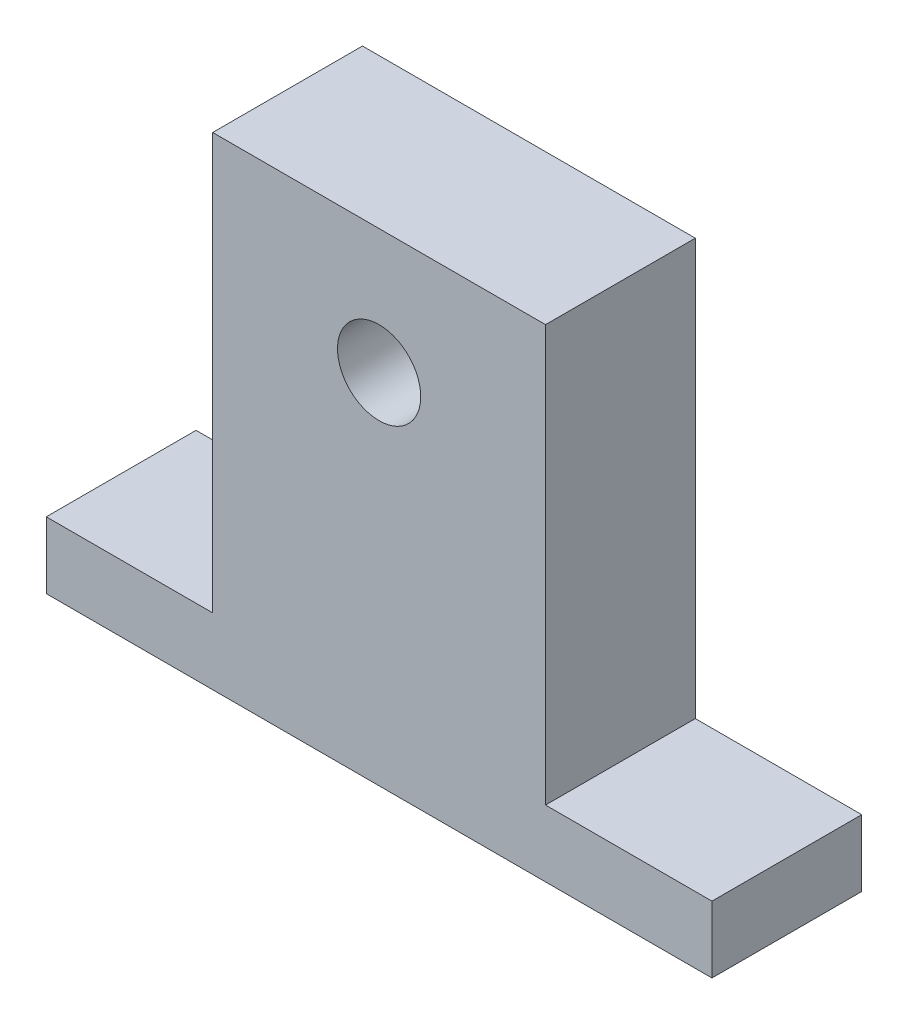
from build123d import *

# Parameters (mm, degrees)
BOSS_EXTRU_2_DEPTH      = 9
ESQUISSE1_4_R           = 2.5
ENL_V_MAT_EXTRU_6_DEPTH = 86.568685861


with BuildPart() as part:
    # Esquisse1 → Boss.-Extru.2 (new body)
    with BuildSketch(Plane.XY):
        Polygon((-40, 0), (-80, 0), (-80, 4), (-70, 4), (-70, 29), (-50, 29), (-50, 4), (-40, 4), align=None)
    extrude(amount=-BOSS_EXTRU_2_DEPTH)

    # Esquisse1<4> → Enlèv. mat.-Extru.6 (cut, through all)
    with BuildSketch(Plane.XY):
        with Locations((-60, 21.5)):
            Circle(ESQUISSE1_4_R)
    extrude(amount=-ENL_V_MAT_EXTRU_6_DEPTH, mode=Mode.SUBTRACT)


solid = part.part
